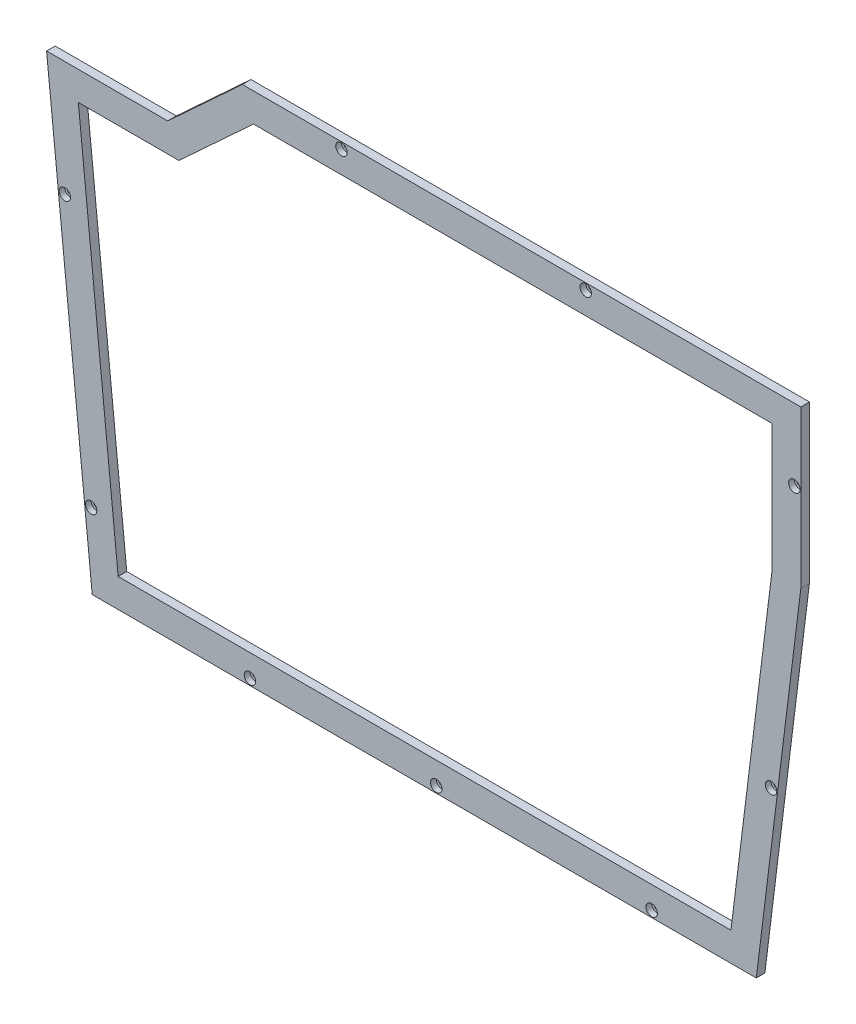
from build123d import *

# Parameters (mm, degrees)
BOSS_EXTRU_1_DEPTH                              = 6
CHAMBRAGE_POUR_VIS_T_TE_CYLINDRIQUE_D           = 4.3
CHAMBRAGE_POUR_VIS_T_TE_CYLINDRIQUE_DEPTH       = 14
CHAMBRAGE_POUR_VIS_T_TE_CYLINDRIQUE_CBORE_D     = 8
CHAMBRAGE_POUR_VIS_T_TE_CYLINDRIQUE_CBORE_DEPTH = 4
CHAMBRAGE_POUR_VIS_T_TE_CYLINDRIQUE_TIP         = 1.291850331


with BuildPart() as part:
    # Esquisse2 → Boss.-Extru.1 (new body)
    with BuildSketch(Plane.XY):
        Polygon((-10.964070347, -65), (20.870792038, -377.3), (483.797653512, -377.3), (514.843253, -126.55504147), (514.843253, -17), (125.48114549, -17), (73.48114549, -65), align=None)
        Polygon((11.178308202, -85), (38.93569862, -357.3), (466.12120793, -357.3), (494.843253, -125.321615981), (494.843253, -37), (133.300822179, -37), (81.300822179, -85), align=None, mode=Mode.SUBTRACT)
    extrude(amount=BOSS_EXTRU_1_DEPTH)

    # Chambrage pour vis à tête cylindrique à 6 pans creux (ou vis CHC) M41
    with Locations(Plane.XY.offset(6)):
        with Locations((1.726692055, -145.122614111), (20.068025449, -325.051094707), (130.819543848, -372.8), (260.695946352, -372.8), (410.870792038, -372.8), (494.109580684, -257.391480805), (510.343253, -67.032082447), (364.912339867, -21.5), (194.606610564, -21.5)):
            CounterBoreHole(CHAMBRAGE_POUR_VIS_T_TE_CYLINDRIQUE_D / 2, CHAMBRAGE_POUR_VIS_T_TE_CYLINDRIQUE_CBORE_D / 2, CHAMBRAGE_POUR_VIS_T_TE_CYLINDRIQUE_CBORE_DEPTH, depth=CHAMBRAGE_POUR_VIS_T_TE_CYLINDRIQUE_DEPTH)
            with Locations((0, 0, -(CHAMBRAGE_POUR_VIS_T_TE_CYLINDRIQUE_DEPTH + CHAMBRAGE_POUR_VIS_T_TE_CYLINDRIQUE_TIP / 2))):  # 118° drill point
                Cone(0, CHAMBRAGE_POUR_VIS_T_TE_CYLINDRIQUE_D / 2, CHAMBRAGE_POUR_VIS_T_TE_CYLINDRIQUE_TIP, mode=Mode.SUBTRACT)


solid = part.part
